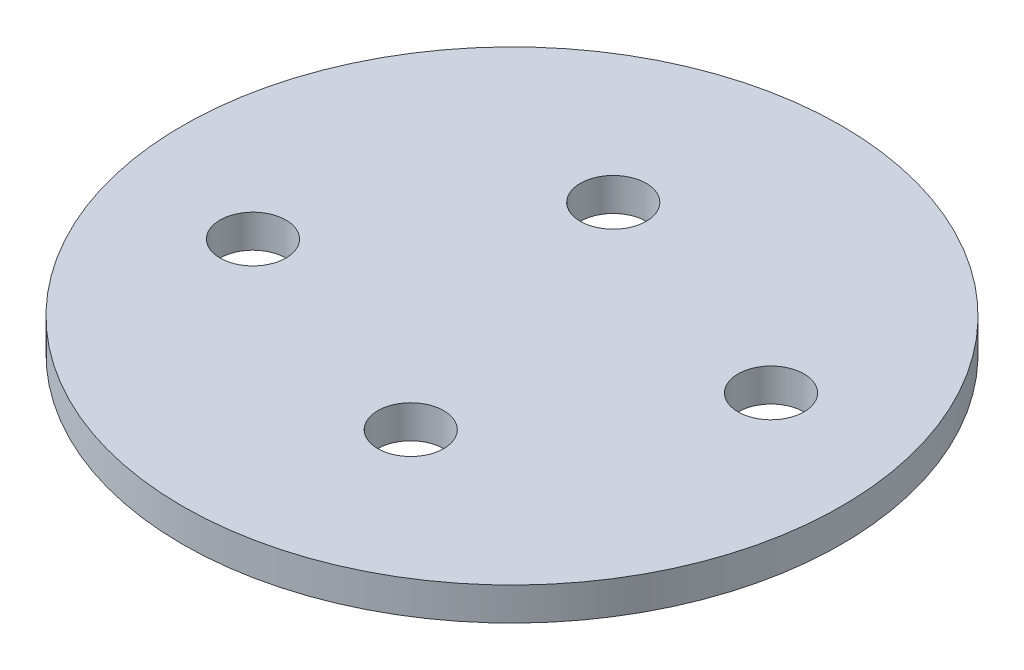
from build123d import *

# Parameters (mm, degrees)
SKETCH2_R           = 20
SKETCH2_R_2         = 2
BOSS_EXTRUDE1_DEPTH = 2


with BuildPart() as part:
    # Sketch2 → Boss-Extrude1 (new body)
    with BuildSketch(Plane(origin=(0, 0, 0), x_dir=(1, 0, 0), z_dir=(0, 1, 0))):
        with Locations(Location((197.989898732, -197.989898732, 0), (0, 0, 270))):
            Circle(SKETCH2_R)
        with Locations(Location((195.08897892, -188.94364734, 0), (0, 0, 270))):
            Circle(SKETCH2_R_2, mode=Mode.SUBTRACT)
        with Locations(Location((209.89286109, -194.17289898, 0), (0, 0, 270))):
            Circle(SKETCH2_R_2, mode=Mode.SUBTRACT)
        with Locations(Location((200.890818544, -207.036150124, 0), (0, 0, 270))):
            Circle(SKETCH2_R_2, mode=Mode.SUBTRACT)
        with Locations(Location((186.086936375, -201.806898485, 0), (0, 0, 270))):
            Circle(SKETCH2_R_2, mode=Mode.SUBTRACT)
    extrude(amount=BOSS_EXTRUDE1_DEPTH)


solid = part.part
